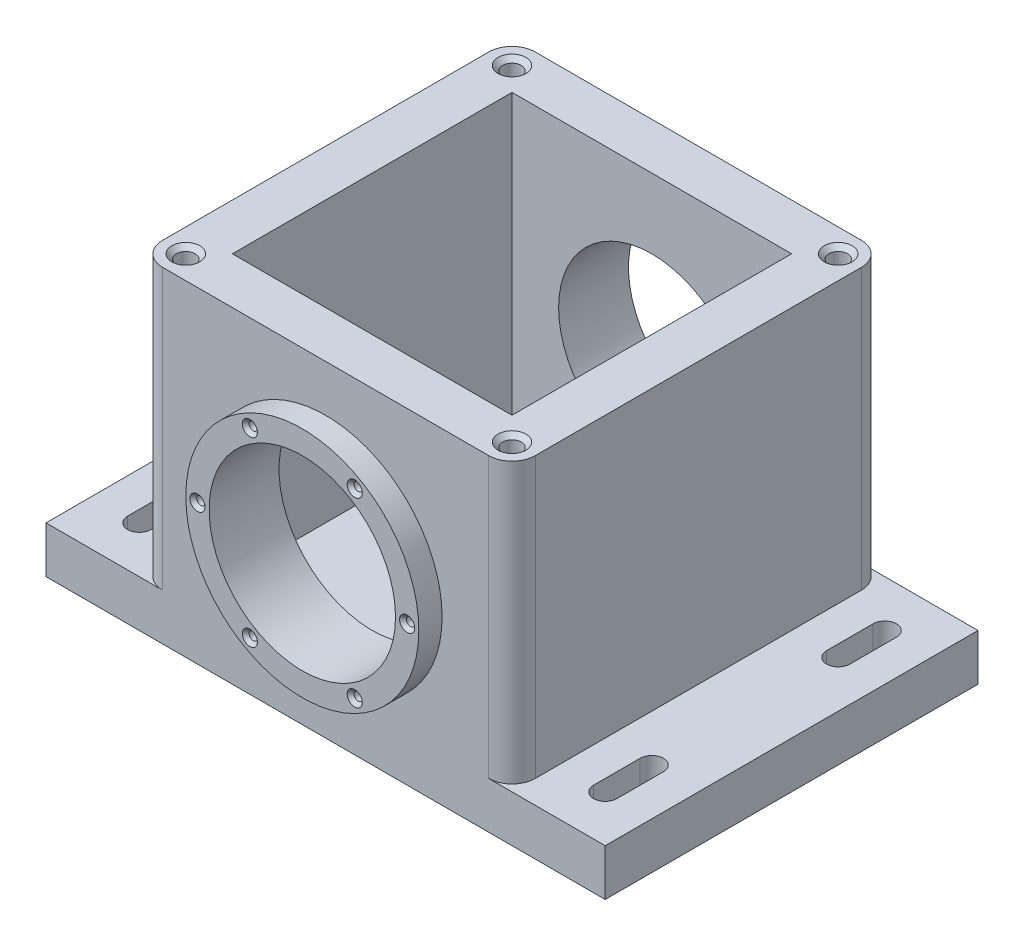
from build123d import *

# Parameters (mm, degrees)
SKETCH1_W                         = 152.4
SKETCH1_H                         = 101.6
BOSS_EXTRUDE1_DEPTH               = 12.7
SKETCH2_W                         = 101.6
SKETCH2_H                         = 101.6
BOSS_EXTRUDE2_DEPTH               = 76.2
SKETCH3_W                         = 76.2
SKETCH3_H                         = 76.2
CUT_EXTRUDE1_DEPTH                = 76.2
SKETCH4_R                         = 31.75
BOSS_EXTRUDE3_DEPTH               = 6.35
SKETCH5_R                         = 25.4
CUT_EXTRUDE2_DEPTH                = 164.628053829
CIRPATTERN1_COUNT                 = 6
FILLET1_R                         = 6.35
F_1_4_20_TAPPED_HOLE1_D           = 5.1054
F_1_4_20_TAPPED_HOLE1_DEPTH       = 19.05
F_1_4_20_TAPPED_HOLE1_CSINK_D     = 7.62
F_1_4_20_TAPPED_HOLE1_CSINK_ANGLE = 90
F_1_4_20_TAPPED_HOLE1_TIP         = 1.533816902
CUT_EXTRUDE3_DEPTH                = 122.979516723
LPATTERN1_COUNT                   = 2
LPATTERN1_PITCH                   = 63.5
MIRROR3_COPY_1_DEPTH              = 122.979516723


with BuildPart() as part:
    # Sketch1 → Boss-Extrude1 (new body)
    with BuildSketch(Plane(origin=(0, 0, 0), x_dir=(1, 0, 0), z_dir=(0, 1, 0))):
        Rectangle(SKETCH1_W, SKETCH1_H)
    extrude(amount=BOSS_EXTRUDE1_DEPTH)

    # Sketch2 → Boss-Extrude2 (add)
    with BuildSketch(Plane(origin=(0, 12.7, 0), x_dir=(1, 0, 0), z_dir=(0, 1, 0))):
        Rectangle(SKETCH2_W, SKETCH2_H)
    extrude(amount=BOSS_EXTRUDE2_DEPTH)

    # Sketch3 → Cut-Extrude1 (cut)
    with BuildSketch(Plane(origin=(0, 88.9, 0), x_dir=(1, 0, 0), z_dir=(0, 1, 0))):
        Rectangle(SKETCH3_W, SKETCH3_H)
    extrude(amount=-CUT_EXTRUDE1_DEPTH, mode=Mode.SUBTRACT)

    # Sketch4 → Boss-Extrude3 (add)
    with BuildSketch(Plane.XY.offset(50.8)):
        with Locations((0, 44.45)):
            Circle(SKETCH4_R)
    boss_extrude3 = extrude(amount=BOSS_EXTRUDE3_DEPTH)

    # Mirror1: Boss-Extrude3 across plane
    add(boss_extrude3.mirror(Plane.XY))

    # Sketch5 → Cut-Extrude2 (cut, through all)
    with BuildSketch(Plane.XY.offset(57.15)):
        with Locations((0, 44.45)):
            Circle(SKETCH5_R)
    extrude(amount=-CUT_EXTRUDE2_DEPTH, mode=Mode.SUBTRACT)

    # Sketch7 → #4-40 Tapped Hole1 (revolve, cut)
    with BuildSketch(Plane(origin=(14.2875, 69.196675913, 57.15), x_dir=(0, -1, 0), z_dir=(1, 0, 0))):
        Polygon((0, 0), (0, 9.569152758), (1.1303, 8.89), (1.1303, 0.9271), (2.0574, 0), align=None)
    f_4_40_tapped_hole1 = revolve(axis=Axis((14.2875, 69.196675913, 63.5), (0, 0, -1)), mode=Mode.SUBTRACT)

    # CirPattern1: #4-40 Tapped Hole1 ×6 about axis
    cirpattern1_axis = Axis((0, 44.45, 0), (0, 0, 1))
    for i in range(1, CIRPATTERN1_COUNT):
        add(f_4_40_tapped_hole1.rotate(cirpattern1_axis, i * 360 / CIRPATTERN1_COUNT), mode=Mode.SUBTRACT)

    # Mirror2: #4-40 Tapped Hole1 across plane
    add(f_4_40_tapped_hole1.mirror(Plane.XY), mode=Mode.SUBTRACT)

    # Mirror2 copy 1 sketch → Mirror2 copy 1 (revolve, cut)
    with BuildSketch(Plane(origin=(-14.2875, 69.196675913, -57.15), x_dir=(0.8660254037844386, -0.5000000000000001, 0), z_dir=(0.5000000000000001, 0.8660254037844386, 0))):
        Polygon((0, 0), (0, -9.569152758), (1.1303, -8.89), (1.1303, -0.9271), (2.0574, 0), align=None)
    revolve(axis=Axis((-14.2875, 69.196675913, -63.5), (0, 0, -1)), mode=Mode.SUBTRACT)

    # Mirror2 copy 2 sketch → Mirror2 copy 2 (revolve, cut)
    with BuildSketch(Plane(origin=(-28.575, 44.45, -57.15), x_dir=(0.8660254037844387, 0.4999999999999998, 0), z_dir=(-0.4999999999999998, 0.8660254037844387, 0))):
        Polygon((0, 0), (0, -9.569152758), (1.1303, -8.89), (1.1303, -0.9271), (2.0574, 0), align=None)
    revolve(axis=Axis((-28.575, 44.45, -63.5), (0, 0, -1)), mode=Mode.SUBTRACT)

    # Mirror2 copy 3 sketch → Mirror2 copy 3 (revolve, cut)
    with BuildSketch(Plane(origin=(-14.2875, 19.703324087, -57.15), x_dir=(0, 1, 0), z_dir=(-1, 0, 0))):
        Polygon((0, 0), (0, -9.569152758), (1.1303, -8.89), (1.1303, -0.9271), (2.0574, 0), align=None)
    revolve(axis=Axis((-14.2875, 19.703324087, -63.5), (0, 0, -1)), mode=Mode.SUBTRACT)

    # Mirror2 copy 4 sketch → Mirror2 copy 4 (revolve, cut)
    with BuildSketch(Plane(origin=(14.2875, 19.703324087, -57.15), x_dir=(-0.8660254037844384, 0.5000000000000004, 0), z_dir=(-0.5000000000000004, -0.8660254037844384, 0))):
        Polygon((0, 0), (0, -9.569152758), (1.1303, -8.89), (1.1303, -0.9271), (2.0574, 0), align=None)
    revolve(axis=Axis((14.2875, 19.703324087, -63.5), (0, 0, -1)), mode=Mode.SUBTRACT)

    # Mirror2 copy 5 sketch → Mirror2 copy 5 (revolve, cut)
    with BuildSketch(Plane(origin=(28.575, 44.45, -57.15), x_dir=(-0.8660254037844386, -0.5000000000000001, 0), z_dir=(0.5000000000000001, -0.8660254037844386, 0))):
        Polygon((0, 0), (0, -9.569152758), (1.1303, -8.89), (1.1303, -0.9271), (2.0574, 0), align=None)
    revolve(axis=Axis((28.575, 44.45, -63.5), (0, 0, -1)), mode=Mode.SUBTRACT)

    # Fillet1
    fillet1_edges = [part.edges().sort_by_distance(p)[0] for p in [
        (50.8, 50.8, 50.8),
        (50.8, 50.8, -50.8),
        (-50.8, 50.8, -50.8),
        (-50.8, 50.8, 50.8),
    ]]
    fillet(fillet1_edges, radius=FILLET1_R)

    # 1/4-20 Tapped Hole1
    with Locations(Plane(origin=(0, 88.9, 0), x_dir=(1, 0, 0), z_dir=(0, 1, 0))):
        with Locations((-44.45, 44.45), (44.45, 44.45), (44.45, -44.45), (-44.45, -44.45)):
            CounterSinkHole(F_1_4_20_TAPPED_HOLE1_D / 2, F_1_4_20_TAPPED_HOLE1_CSINK_D / 2, depth=F_1_4_20_TAPPED_HOLE1_DEPTH, counter_sink_angle=F_1_4_20_TAPPED_HOLE1_CSINK_ANGLE)
            with Locations((0, 0, -(F_1_4_20_TAPPED_HOLE1_DEPTH + F_1_4_20_TAPPED_HOLE1_TIP / 2))):  # 118° drill point
                Cone(0, F_1_4_20_TAPPED_HOLE1_D / 2, F_1_4_20_TAPPED_HOLE1_TIP, mode=Mode.SUBTRACT)

    # Sketch12 → Cut-Extrude3 (cut, through all)
    with BuildSketch(Plane(origin=(0, 12.7, 0), x_dir=(1, 0, 0), z_dir=(0, 1, 0))):
        with BuildLine():
            Line((66.675, -25.4), (66.675, -38.1))
            ThreePointArc((66.675, -38.1), (63.5, -41.275), (60.325, -38.1))
            Line((60.325, -38.1), (60.325, -25.4))
            ThreePointArc((60.325, -25.4), (63.5, -22.225), (66.675, -25.4))
        make_face()
    cut_extrude3 = extrude(amount=-CUT_EXTRUDE3_DEPTH, mode=Mode.SUBTRACT)

    # LPattern1: Cut-Extrude3 ×2
    with Locations(*[(0, 0, -i * LPATTERN1_PITCH) for i in range(1, LPATTERN1_COUNT)]):
        add(cut_extrude3, mode=Mode.SUBTRACT)

    # Mirror3: Cut-Extrude3 across plane
    add(cut_extrude3.mirror(Plane(origin=(0, 0, 0), x_dir=(0, 0, 1), z_dir=(1, 0, 0))), mode=Mode.SUBTRACT)

    # Mirror3 copy 1 sketch → Mirror3 copy 1 (cut, through all)
    with BuildSketch(Plane(origin=(0, 12.7, -63.5), x_dir=(-1, 0, 0), z_dir=(0, 1, 0))):
        with BuildLine():
            Line((66.675, 25.4), (66.675, 38.1))
            ThreePointArc((66.675, 38.1), (63.5, 41.275), (60.325, 38.1))
            Line((60.325, 38.1), (60.325, 25.4))
            ThreePointArc((60.325, 25.4), (63.5, 22.225), (66.675, 25.4))
        make_face()
    extrude(amount=-MIRROR3_COPY_1_DEPTH, mode=Mode.SUBTRACT)


solid = part.part
